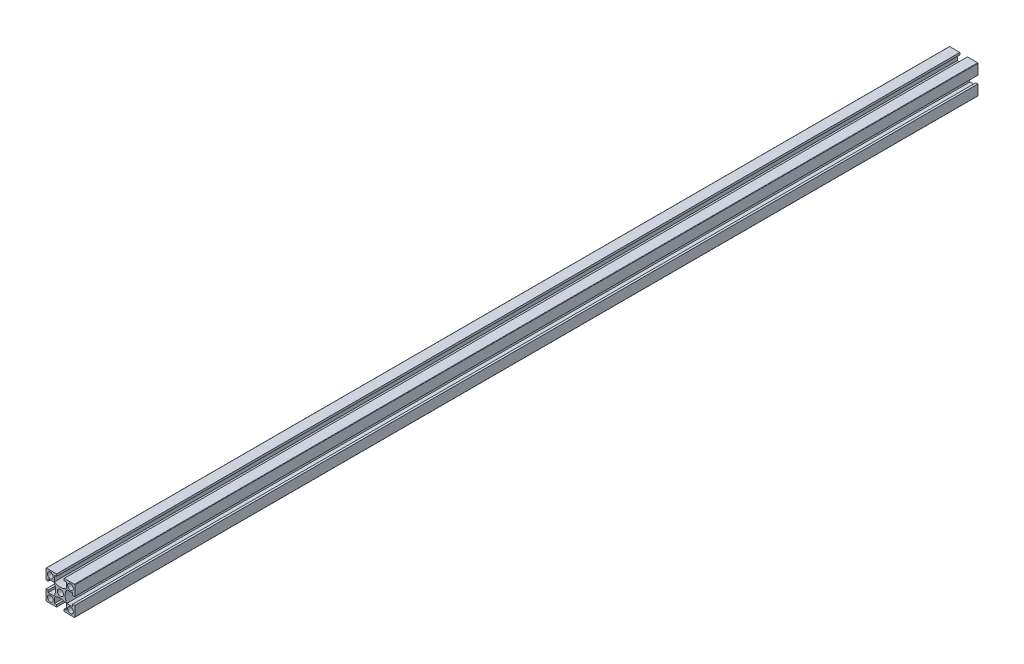
from build123d import *

# Parameters (mm, degrees)
SKETCH_1_W               = 20
SKETCH_1_H               = 20
SKETCH_1_R               = 2
SKETCH_1_R_2             = 2.15
EXTRUDE_1_DEPTH          = 628
CUT_EXTRUDE_1_REACH      = 630.159
PATTERN_CIRCULAR_1_COUNT = 4
FILLET_1_R               = 0.3
CUT_EXTRUDE_2_DEPTH      = 629.159215486
CUT_EXTRUDE_2_DEPTH_BACK = 629.159215486
SKETCH_2_R               = 2.5
SKETCH_3_R               = 2.5
CUT_EXTRUDE_3_DEPTH      = 629.397963177
SKETCH_4_R               = 2.5
CUT_EXTRUDE_4_DEPTH      = 629.397963177
SKETCH_5_R               = 2.15
SKETCH_5_R_2             = 2.12
CUT_EXTRUDE_5_DEPTH      = 629.397963177


with BuildPart() as part:
    # 스케치1 → 보스-돌출1 (new body)
    with BuildSketch(Plane.XY):
        Rectangle(SKETCH_1_W, SKETCH_1_H)
        with Locations((-7, -7)):
            Circle(SKETCH_1_R, mode=Mode.SUBTRACT)
        with Locations((7, -7)):
            Circle(SKETCH_1_R, mode=Mode.SUBTRACT)
        with Locations((-7, 7)):
            Circle(SKETCH_1_R, mode=Mode.SUBTRACT)
        Circle(SKETCH_1_R_2, mode=Mode.SUBTRACT)
        with Locations((7, 7)):
            Circle(SKETCH_1_R, mode=Mode.SUBTRACT)
    extrude(amount=EXTRUDE_1_DEPTH)

    # 스케치1<3> → 컷-돌출1 (cut, up to next)
    with BuildSketch(Plane.XY, mode=Mode.PRIVATE) as cut_extrude_1_sk1:
        with BuildLine():
            Line((-8.5, 2.65), (-10, 2.65))
            Line((-10, 2.65), (-10, -2.65))
            Line((-10, -2.65), (-8.5, -2.65))
            Line((-8.5, -2.65), (-8.5, -4.15))
            Line((-8.5, -4.15), (-4.503166667, -4.15))
            ThreePointArc((-4.503166667, -4.15), (-3.3, 0), (-4.503166667, 4.15))
            Line((-4.503166667, 4.15), (-8.5, 4.15))
            Line((-8.5, 4.15), (-8.5, 2.65))
        make_face()
    cut_extrude_1_tool1 = extrude(cut_extrude_1_sk1.sketch, amount=CUT_EXTRUDE_1_REACH, mode=Mode.PRIVATE) & part.part
    cut_extrude_1 = cut_extrude_1_tool1.solids().sort_by_distance((-6.606913, 0, 0))[0]
    add(cut_extrude_1, mode=Mode.SUBTRACT)

    # 원형 패턴1: 컷-돌출1 ×4 about axis
    pattern_circular_1_axis = Axis((0, 0, 628), (0, 0, -1))
    for i in range(1, PATTERN_CIRCULAR_1_COUNT):
        add(cut_extrude_1.rotate(pattern_circular_1_axis, i * 360 / PATTERN_CIRCULAR_1_COUNT), mode=Mode.SUBTRACT)

    # 필렛1
    fillet_1_edges = [part.edges().sort_by_distance(p)[0] for p in [
        (10, -10, 314),
        (-10, -10, 314),
        (-10, 10, 314),
        (10, 10, 314),
    ]]
    fillet(fillet_1_edges, radius=FILLET_1_R)

    # 스케치2 → 컷-돌출2 (cut, two sides: drawn at the far end of the back side and taken through both)
    with BuildSketch(Plane(origin=(0, 0, 0), x_dir=(0, 0, -1), z_dir=(1, 0, 0)).offset(-CUT_EXTRUDE_2_DEPTH_BACK)):
        with Locations((-15, 0)):
            Circle(SKETCH_2_R)
    extrude(amount=CUT_EXTRUDE_2_DEPTH + CUT_EXTRUDE_2_DEPTH_BACK, mode=Mode.SUBTRACT)

    # 스케치3 → 컷-돌출3 (cut, through all)
    with BuildSketch(Plane.XZ.offset(10)):
        with Locations((0, 141)):
            Circle(SKETCH_3_R)
        with Locations((0, 357)):
            Circle(SKETCH_3_R)
    extrude(amount=-CUT_EXTRUDE_3_DEPTH, mode=Mode.SUBTRACT)

    # 스케치4 → 컷-돌출4 (cut, through all)
    with BuildSketch(Plane.XZ.offset(10)):
        with Locations((0, 249)):
            Circle(SKETCH_4_R)
    extrude(amount=-CUT_EXTRUDE_4_DEPTH, mode=Mode.SUBTRACT)

    # 스케치5 → 컷-돌출5 (cut, through all)
    with BuildSketch(Plane.XZ.offset(10)):
        with Locations((0, 475)):
            Circle(SKETCH_5_R)
        with Locations((0, 423)):
            Circle(SKETCH_5_R)
        with Locations((0, 305)):
            Circle(SKETCH_5_R_2)
        with Locations((0, 238.9)):
            Circle(SKETCH_5_R)
        with Locations((0, 186.9)):
            Circle(SKETCH_5_R)
        with Locations((0, 64.15)):
            Circle(SKETCH_5_R)
        with Locations((0, 12.15)):
            Circle(SKETCH_5_R)
    extrude(amount=-CUT_EXTRUDE_5_DEPTH, mode=Mode.SUBTRACT)


solid = part.part
